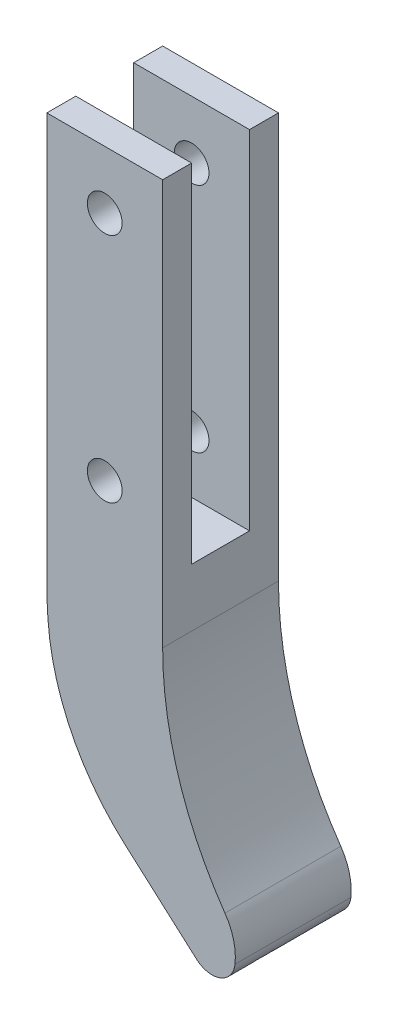
from build123d import *

# Parameters (mm, degrees)
BOSS_EXTRU_1_DEPTH      = 10
ESQUISSE2_W             = 5
ESQUISSE2_H             = 30
ENL_V_MAT_EXTRU_1_DEPTH = 62.64414003
ESQUISSE3_R             = 1.5
ENL_V_MAT_EXTRU_2_DEPTH = 63.967823601
ESQUISSE5_R             = 1.5
ENL_V_MAT_EXTRU_3_DEPTH = 63.967823601
ENL_V_MAT_EXTRU_4_DEPTH = 63.967823601
CONG_VARIABLE1_R        = 2
CONG_4_R                = 20


with BuildPart() as part:
    # Esquisse1 → Boss.-Extru.1 (new body)
    with BuildSketch(Plane.XY):
        with BuildLine():
            Line((10, 0), (0, 0))
            Line((0, 0), (0, -35))
            ThreePointArc((0, -35), (1.835599765, -46.978253407), (7.173927734, -57.857142857))
            ThreePointArc((7.173927734, -57.857142857), (14.134329624, -59.103259033), (15.380445801, -52.142857143))
            ThreePointArc((15.380445801, -52.142857143), (11.376699824, -43.983690055), (10, -35))
            Line((10, -35), (10, 0))
        make_face()
    extrude(amount=BOSS_EXTRU_1_DEPTH)

    # Esquisse2 → Enlèv. mat.-Extru.1 (cut, through all)
    with BuildSketch(Plane(origin=(10, 0, 0), x_dir=(0, 0, -1), z_dir=(1, 0, 0))):
        with Locations((-5, -15)):
            Rectangle(ESQUISSE2_W, ESQUISSE2_H)
    extrude(amount=-ENL_V_MAT_EXTRU_1_DEPTH, mode=Mode.SUBTRACT)

    # Esquisse3 → Enlèv. mat.-Extru.2 (cut, through all)
    with BuildSketch(Plane.XY.offset(10)):
        with Locations((5, -5)):
            Circle(ESQUISSE3_R)
    extrude(amount=-ENL_V_MAT_EXTRU_2_DEPTH, mode=Mode.SUBTRACT)

    # Esquisse5 → Enlèv. mat.-Extru.3 (cut, through all)
    with BuildSketch(Plane.XY.offset(10)):
        with Locations((5, -25)):
            Circle(ESQUISSE5_R)
    extrude(amount=-ENL_V_MAT_EXTRU_3_DEPTH, mode=Mode.SUBTRACT)

    # Esquisse6 → Enlèv. mat.-Extru.4 (cut, through all)
    with BuildSketch(Plane.XY.offset(10)):
        with BuildLine():
            Line((14.840420876, -58.507614957), (1.835599765, -46.978253407))
            ThreePointArc((1.835599765, -46.978253407), (4.090400233, -52.621028477), (7.173927734, -57.857142857))
            ThreePointArc((7.173927734, -57.857142857), (10.854475024, -59.982099435), (14.840420876, -58.507614957))
        make_face()
    extrude(amount=-ENL_V_MAT_EXTRU_4_DEPTH, mode=Mode.SUBTRACT)

    # Congé variable1
    cong_variable1_edges = [part.edges().sort_by_distance(p)[0] for p in [
        (14.840420876, -58.507614957, 5),
    ]]
    fillet(cong_variable1_edges, radius=CONG_VARIABLE1_R)

    # Congé4
    cong_4_edges = [part.edges().sort_by_distance(p)[0] for p in [
        (1.835599765, -46.978253407, 5),
    ]]
    fillet(cong_4_edges, radius=CONG_4_R)


solid = part.part
